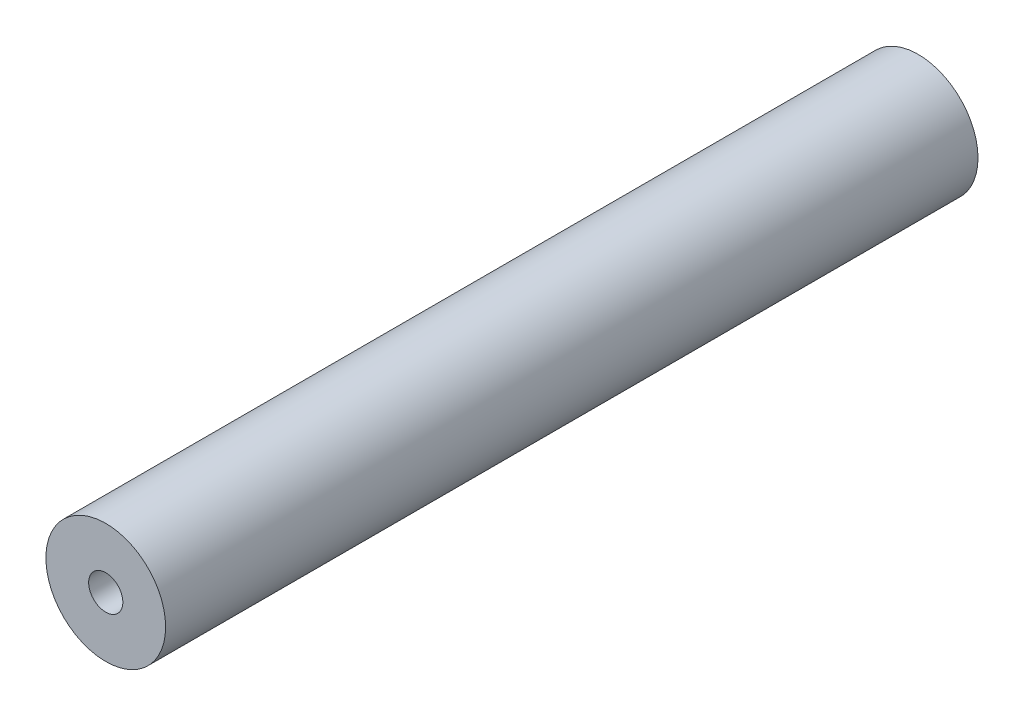
from build123d import *

# Parameters (mm, degrees)
SKETCH_1_R          = 7
EXTRUDE_1_DEPTH     = 95
SKETCH_2_R          = 2
CUT_EXTRUDE_1_DEPTH = 65


with BuildPart() as part:
    # 草图1 → 凸台-拉伸1 (new body)
    with BuildSketch(Plane.XY):
        Circle(SKETCH_1_R)
    extrude(amount=EXTRUDE_1_DEPTH)

    # 草图2 → 切除-拉伸1 (cut)
    with BuildSketch(Plane.XY.offset(95)):
        Circle(SKETCH_2_R)
    extrude(amount=-CUT_EXTRUDE_1_DEPTH, mode=Mode.SUBTRACT)


solid = part.part
